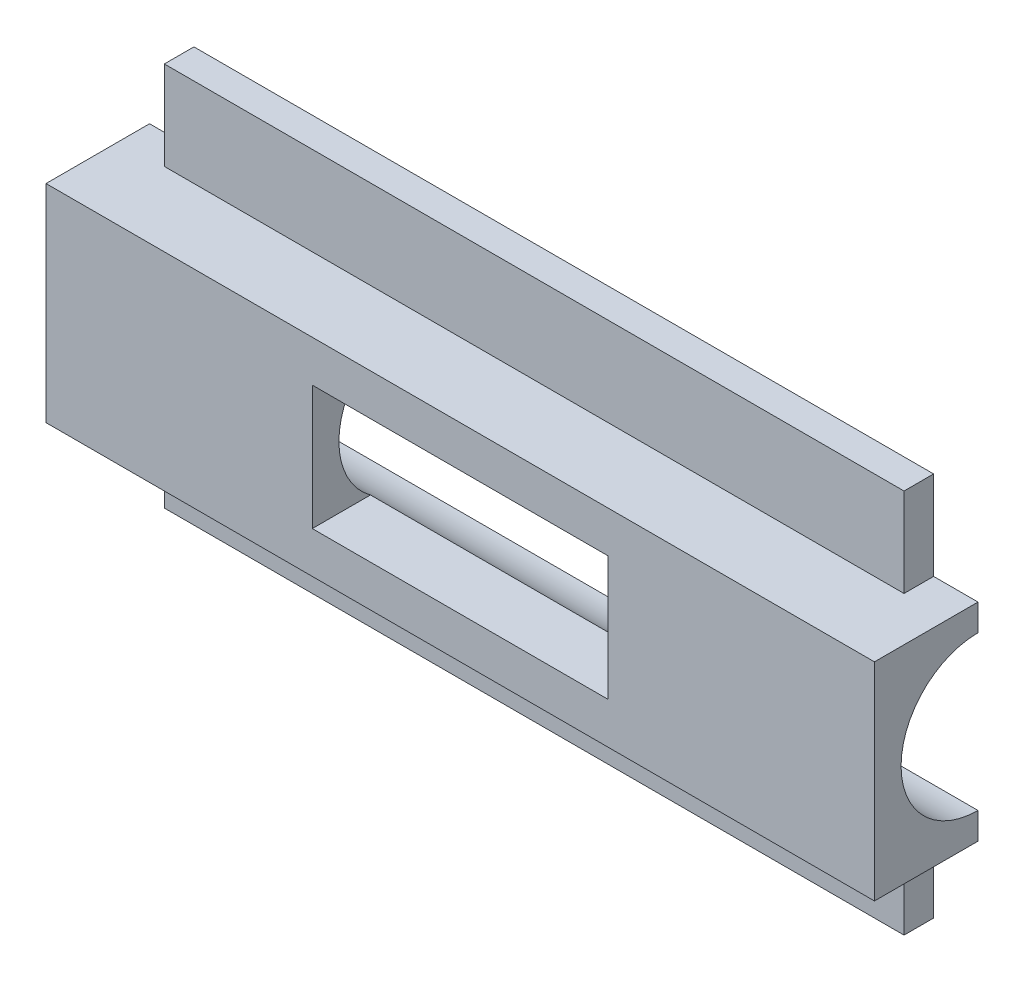
from build123d import *

# Parameters (mm, degrees)
CROQUIS2_W                   = 140
CROQUIS2_H                   = 35
SALIENTE_EXTRUIR1_DEPTH      = 17.5
SALIENTE_EXTRUIR2_DEPTH      = 15
SALIENTE_EXTRUIR2_DEPTH_BACK = 50
CROQUIS3_W                   = 125
CROQUIS3_H                   = 5
CROQUIS4_R                   = 13
CORTAR_EXTRUIR1_DEPTH        = 140
CROQUIS5_W                   = 50
CROQUIS5_H                   = 21
CORTAR_EXTRUIR2_DEPTH        = 192.605062564


with BuildPart() as part:
    # Croquis2 → Saliente-Extruir1 (new body)
    with BuildSketch(Plane.XY):
        with Locations((0, 145)):
            Rectangle(CROQUIS2_W, CROQUIS2_H)
    extrude(amount=SALIENTE_EXTRUIR1_DEPTH)

    # Croquis3 → Saliente-Extruir2 (add, two sides: drawn at the far end of the back side and taken through both)
    with BuildSketch(Plane.XZ.offset(-127.5).offset(-SALIENTE_EXTRUIR2_DEPTH_BACK)):
        with Locations((0, 2.5)):
            Rectangle(CROQUIS3_W, CROQUIS3_H)
    extrude(amount=SALIENTE_EXTRUIR2_DEPTH + SALIENTE_EXTRUIR2_DEPTH_BACK)

    # Croquis4 → Cortar-Extruir1 (cut)
    with BuildSketch(Plane(origin=(70, 0, 0), x_dir=(0, 0, -1), z_dir=(1, 0, 0))):
        with Locations((0, 145)):
            Circle(CROQUIS4_R)
    extrude(amount=-CORTAR_EXTRUIR1_DEPTH, mode=Mode.SUBTRACT)

    # Croquis5 → Cortar-Extruir2 (cut, through all)
    with BuildSketch(Plane.XY.offset(17.5)):
        with Locations((0, 145)):
            Rectangle(CROQUIS5_W, CROQUIS5_H)
    extrude(amount=-CORTAR_EXTRUIR2_DEPTH, mode=Mode.SUBTRACT)


solid = part.part
